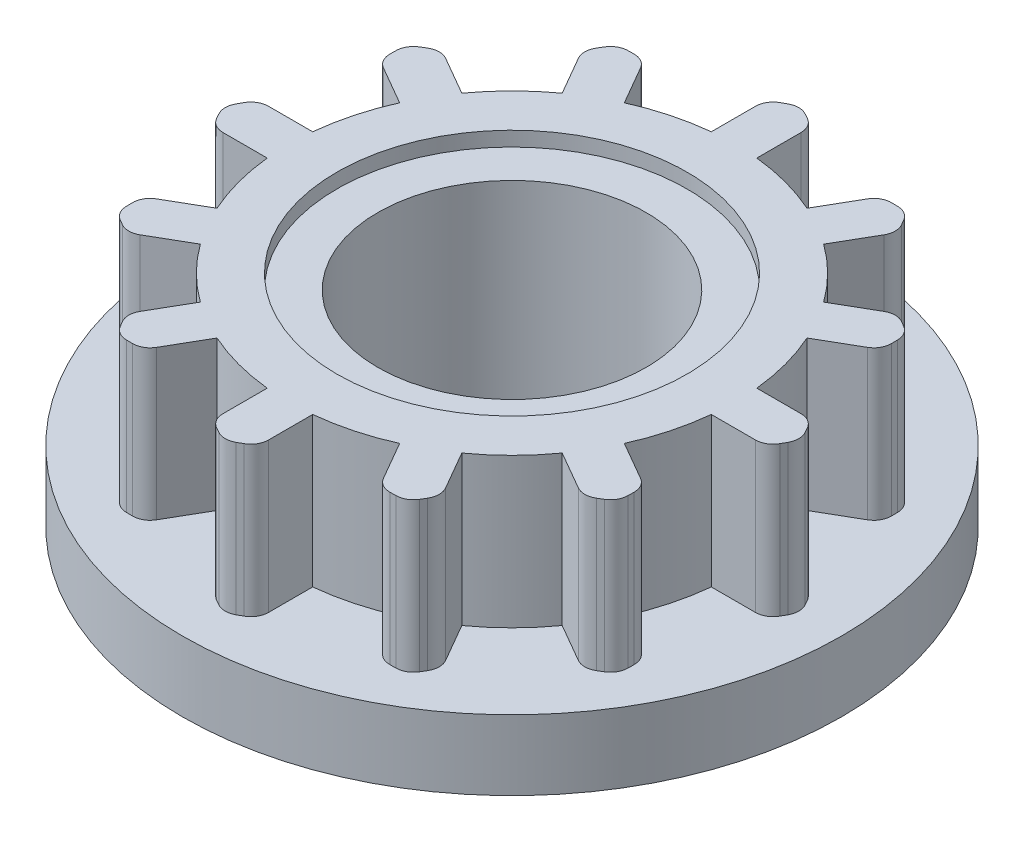
from build123d import *

# Parameters (mm, degrees)
SKETCH2_R                 = 5.65
BOSS_EXTRUDE1_DEPTH       = 1.2
SKETCH3_R                 = 3.825
BOSS_EXTRUDE2_DEPTH       = 2.56
SKETCH5_R                 = 3.9
BOSS_EXTRUDE4_DEPTH       = 0.9
BOSS_EXTRUDE5_DEPTH       = 2.56
FILLET12_R                = 0.3
CIRPATTERN3_COUNT         = 12
FILLET12_OF_CIRPATTERN3_R = 0.3
SKETCH10_R                = 2.3
CUT_EXTRUDE3_DEPTH        = 10.249897297
SKETCH11_R                = 3
CUT_EXTRUDE4_DEPTH        = 0.25


with BuildPart() as part:
    # Sketch2 → Boss-Extrude1 (new body)
    with BuildSketch(Plane(origin=(0, 0, 0), x_dir=(1, 0, 0), z_dir=(0, 1, 0))):
        with Locations(Location((0, 0, 0), (0, 0, 270))):
            Circle(SKETCH2_R)
    extrude(amount=BOSS_EXTRUDE1_DEPTH)

    # Sketch3 → Boss-Extrude2 (add)
    with BuildSketch(Plane(origin=(0, 1.2, 0), x_dir=(1, 0, 0), z_dir=(0, 1, 0))):
        with Locations(Location((0, 0, 0), (0, 0, 90))):
            Circle(SKETCH3_R)
    extrude(amount=BOSS_EXTRUDE2_DEPTH)

    # Sketch5 → Boss-Extrude4 (add)
    with BuildSketch(Plane.XZ):
        with Locations(Location((0, 0, 0), (0, 0, 270))):
            Circle(SKETCH5_R)
    extrude(amount=BOSS_EXTRUDE4_DEPTH)

    # Sketch9 → Boss-Extrude5 (add)
    with BuildSketch(Plane(origin=(0, 1.2, 0), x_dir=(1, 0, 0), z_dir=(0, 1, 0))):
        Polygon((0.39, 2.91), (-0.39, 2.91), (-0.39, 4.74), (0, 4.957049268), (0.39, 4.74), align=None)
    boss_extrude5 = extrude(amount=BOSS_EXTRUDE5_DEPTH)

    # Fillet12
    fillet12_edges = [part.edges().sort_by_distance(p)[0] for p in [
        (-0.39, 2.48, -4.74),
        (0, 2.48, -4.957049268),
        (0.39, 2.48, -4.74),
    ]]
    fillet(fillet12_edges, radius=FILLET12_R)

    # CirPattern3: Boss-Extrude5 ×12 about axis
    cirpattern3_axis = Axis((0, 0, 0), (0, 1, 0))
    for i in range(1, CIRPATTERN3_COUNT):
        add(boss_extrude5.rotate(cirpattern3_axis, i * 360 / CIRPATTERN3_COUNT))

    # Fillet12 of CirPattern3
    fillet12_of_cirpattern3_edges = [part.edges().sort_by_distance(p)[0] for p in [
        (-2.707749907, 2.48, -3.909960414),
        (-2.478524634, 2.48, -4.292930594),
        (-2.032250093, 2.48, -4.299960414),
        (-4.299960414, 2.48, -2.032250093),
        (-4.292930594, 2.48, -2.478524634),
        (-3.909960414, 2.48, -2.707749907),
        (-4.74, 2.48, 0.39),
        (-4.957049268, 2.48, 0),
        (-4.74, 2.48, -0.39),
        (-3.909960414, 2.48, 2.707749907),
        (-4.292930594, 2.48, 2.478524634),
        (-4.299960414, 2.48, 2.032250093),
        (-2.032250093, 2.48, 4.299960414),
        (-2.478524634, 2.48, 4.292930594),
        (-2.707749907, 2.48, 3.909960414),
        (0.39, 2.48, 4.74),
        (0, 2.48, 4.957049268),
        (-0.39, 2.48, 4.74),
        (2.707749907, 2.48, 3.909960414),
        (2.478524634, 2.48, 4.292930594),
        (2.032250093, 2.48, 4.299960414),
        (4.299960414, 2.48, 2.032250093),
        (4.292930594, 2.48, 2.478524634),
        (3.909960414, 2.48, 2.707749907),
        (4.74, 2.48, -0.39),
        (4.957049268, 2.48, 0),
        (4.74, 2.48, 0.39),
        (3.909960414, 2.48, -2.707749907),
        (4.292930594, 2.48, -2.478524634),
        (4.299960414, 2.48, -2.032250093),
        (2.032250093, 2.48, -4.299960414),
        (2.478524634, 2.48, -4.292930594),
        (2.707749907, 2.48, -3.909960414),
    ]]
    fillet(fillet12_of_cirpattern3_edges, radius=FILLET12_OF_CIRPATTERN3_R)

    # Sketch10 → Cut-Extrude3 (cut, through all)
    with BuildSketch(Plane(origin=(0, 3.76, 0), x_dir=(1, 0, 0), z_dir=(0, 1, 0))):
        with Locations(Location((0, 0, 0), (0, 0, 270))):
            Circle(SKETCH10_R)
    extrude(amount=-CUT_EXTRUDE3_DEPTH, mode=Mode.SUBTRACT)

    # Sketch11 → Cut-Extrude4 (cut)
    with BuildSketch(Plane(origin=(0, 3.76, 0), x_dir=(1, 0, 0), z_dir=(0, 1, 0))):
        with Locations(Location((0, 0, 0), (0, 0, 270))):
            Circle(SKETCH11_R)
    extrude(amount=-CUT_EXTRUDE4_DEPTH, mode=Mode.SUBTRACT)


solid = part.part
